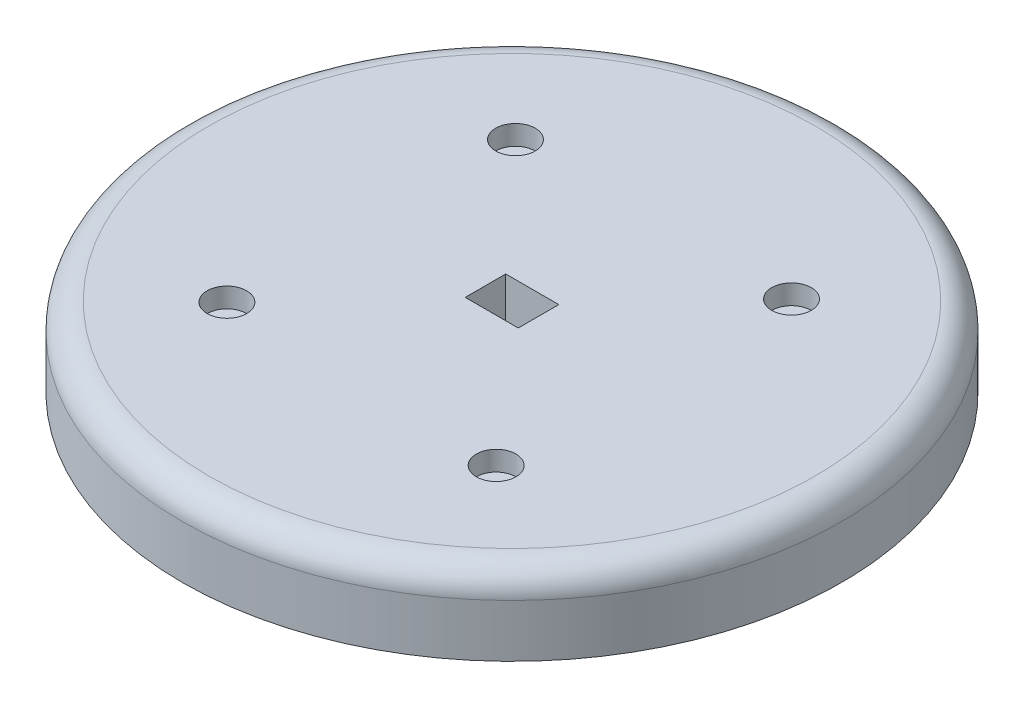
from build123d import *

# Parameters (mm, degrees)
SKETCH_1_R          = 50
EXTRUDE_1_DEPTH     = 12
FILLET_1_R          = 4
SKETCH_5_R          = 3
CUT_EXTRUDE_1_DEPTH = 3
SKETCH_7_W          = 8.05
SKETCH_7_H          = 6.15
CUT_EXTRUDE_2_DEPTH = 72.721684308


with BuildPart() as part:
    # 草图1 → 凸台-拉伸1 (new body)
    with BuildSketch(Plane(origin=(0, 0, 0), x_dir=(1, 0, 0), z_dir=(0, 1, 0))):
        with Locations(Location((0, 0, 0), (0, 0, 270))):
            Circle(SKETCH_1_R)
    extrude(amount=EXTRUDE_1_DEPTH)

    # 圆角1
    fillet_1_edges = [part.edges().sort_by_distance(p)[0] for p in [
        (0, 12, -50),
    ]]
    fillet(fillet_1_edges, radius=FILLET_1_R)

    # 草图5 → 切除-拉伸1 (cut)
    with BuildSketch(Plane(origin=(0, 12, 0), x_dir=(1, 0, 0), z_dir=(0, 1, 0))):
        with Locations(Location((-20.941763413, 21.466971597, 0), (0, 0, 270))):
            Circle(SKETCH_5_R)
        with Locations(Location((20.941763413, 21.466971597, 0), (0, 0, 90))):
            Circle(SKETCH_5_R)
        with Locations(Location((20.399845913, -22.80585614, 0), (0, 0, 270))):
            Circle(SKETCH_5_R)
        with Locations(Location((-21.471132177, -21.780666781, 0), (0, 0, 90))):
            Circle(SKETCH_5_R)
    extrude(amount=-CUT_EXTRUDE_1_DEPTH, mode=Mode.SUBTRACT)

    # 草图7 → 切除-拉伸2 (cut, through all)
    with BuildSketch(Plane(origin=(0, 12, 0), x_dir=(1, 0, 0), z_dir=(0, 1, 0))):
        Rectangle(SKETCH_7_W, SKETCH_7_H)
    extrude(amount=-CUT_EXTRUDE_2_DEPTH, mode=Mode.SUBTRACT)


solid = part.part
